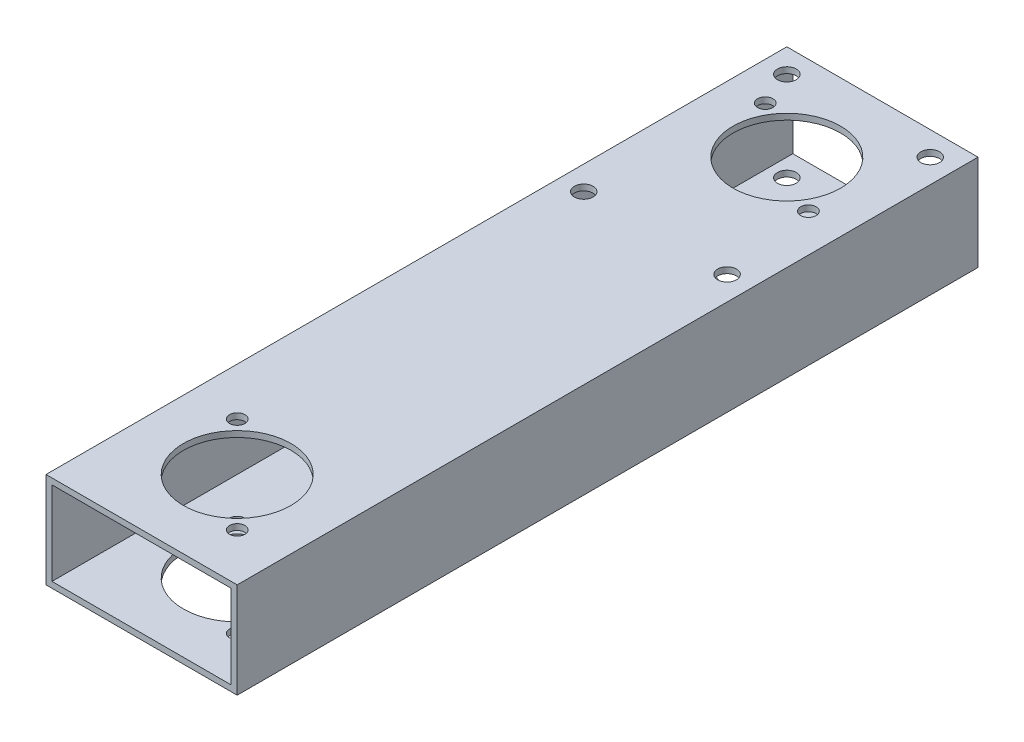
from build123d import *

# Parameters (mm, degrees)
BOSS_EXTRUDE1_DEPTH         = 98.424999
BOSS_EXTRUDE1_DEPTH_BACK    = 98.424999
SKETCH3_W                   = 50.8
SKETCH3_H                   = 25.4
SKETCH3_W_2                 = 47.625
SKETCH3_H_2                 = 22.225
SKETCH4_R                   = 14.2875
CUT_EXTRUDE3_DEPTH          = 105.774999061
F_10_CLEARANCE_HOLE1_D      = 4.9784
F_20_0_161_DIAMETER_HOLE1_D = 4.0894
F_20_0_161_DIAMETER_HOLE2_D = 4.0894


with BuildPart() as part:
    # Sketch3 → Boss-Extrude1 (new, two sides: drawn at the far end of the back side and taken through both)
    with BuildSketch(Plane.XY.offset(-BOSS_EXTRUDE1_DEPTH_BACK)):
        Rectangle(SKETCH3_W, SKETCH3_H)
        Rectangle(SKETCH3_W_2, SKETCH3_H_2, mode=Mode.SUBTRACT)
    extrude(amount=BOSS_EXTRUDE1_DEPTH + BOSS_EXTRUDE1_DEPTH_BACK)

    # Sketch4 → Cut-Extrude3 (cut, through all)
    with BuildSketch(Plane.XZ.offset(12.7)):
        with Locations((0, 73.025)):
            Circle(SKETCH4_R)
        with Locations((0, -73.025)):
            Circle(SKETCH4_R)
    extrude(amount=-CUT_EXTRUDE3_DEPTH, mode=Mode.SUBTRACT)

    # #10 Clearance Hole1 (through all)
    with Locations(Plane(origin=(0, 12.7, 0), x_dir=(1, 0, 0), z_dir=(0, 1, 0))):
        with Locations((19.05, 38.099999492), (19.05, 92.074999492), (-19.05, 92.074999492), (-19.05, 38.099999492)):
            Hole(F_10_CLEARANCE_HOLE1_D / 2)

    # #20 (0.161) Diameter Hole1 (through all)
    with Locations(Plane(origin=(0, 12.7, 0), x_dir=(1, 0, 0), z_dir=(0, 1, 0))):
        with Locations((-12.751963692, -60.273036308), (12.751963691, -85.776963692)):
            Hole(F_20_0_161_DIAMETER_HOLE1_D / 2)

    # #20 (0.161) Diameter Hole2 (through all)
    with Locations(Plane(origin=(0, 12.7, 0), x_dir=(1, 0, 0), z_dir=(0, 1, 0))):
        with Locations((-15.293699364, 82.581564015), (15.293699363, 63.468435985)):
            Hole(F_20_0_161_DIAMETER_HOLE2_D / 2)


solid = part.part
